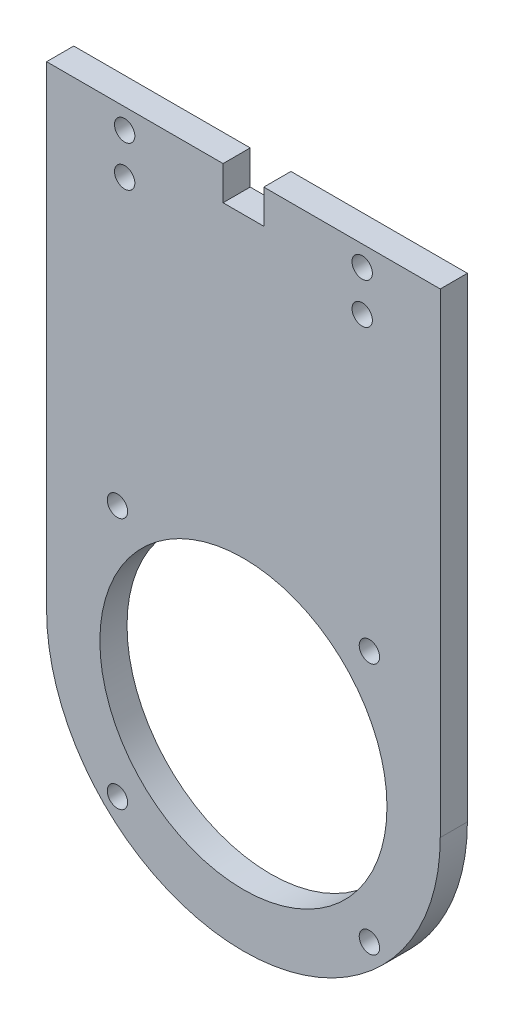
from build123d import *

# Parameters (mm, degrees)
SKETCH_1_R          = 21.15
SKETCH_1_R_2        = 1.5
EXTRUDE_1_DEPTH     = 4
SKETCH_2_W          = 6
SKETCH_2_H          = 5
CUT_EXTRUDE_1_DEPTH = 98.49871794


with BuildPart() as part:
    # 草图1 → 凸台-拉伸1 (new body)
    with BuildSketch(Plane.XY):
        with BuildLine():
            Line((-29, 6), (29, 6))
            Line((29, 6), (29, -64))
            ThreePointArc((29, -64), (0, -93), (-29, -64))
            Line((-29, -64), (-29, 6))
        make_face()
        with Locations((0, -64)):
            Circle(SKETCH_1_R, mode=Mode.SUBTRACT)
        with Locations((-17.5, 3)):
            Circle(SKETCH_1_R_2, mode=Mode.SUBTRACT)
        with Locations((17.5, 3)):
            Circle(SKETCH_1_R_2, mode=Mode.SUBTRACT)
        with Locations((18.561553006, -82.561553006)):
            Circle(SKETCH_1_R_2, mode=Mode.SUBTRACT)
        with Locations((-18.561553006, -82.561553006)):
            Circle(SKETCH_1_R_2, mode=Mode.SUBTRACT)
        with Locations((-18.561553006, -45.438446994)):
            Circle(SKETCH_1_R_2, mode=Mode.SUBTRACT)
        with Locations((18.561553006, -45.438446994)):
            Circle(SKETCH_1_R_2, mode=Mode.SUBTRACT)
        with Locations((-17.5, -3)):
            Circle(SKETCH_1_R_2, mode=Mode.SUBTRACT)
        with Locations((17.5, -3)):
            Circle(SKETCH_1_R_2, mode=Mode.SUBTRACT)
    extrude(amount=EXTRUDE_1_DEPTH)

    # 草图2 → 切除-拉伸1 (cut, through all)
    with BuildSketch(Plane.XY.offset(4)):
        with Locations((0, 3.5)):
            Rectangle(SKETCH_2_W, SKETCH_2_H)
    extrude(amount=-CUT_EXTRUDE_1_DEPTH, mode=Mode.SUBTRACT)


solid = part.part
